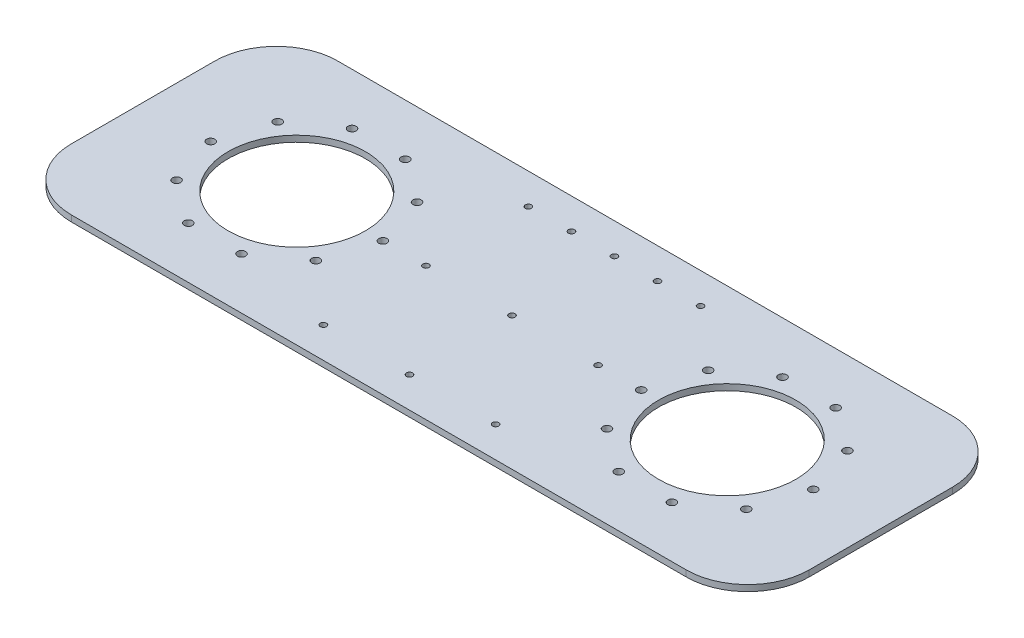
from build123d import *

# Parameters (mm, degrees)
SKETCH_1_R               = 33.5
EXTRUDE_1_DEPTH          = 3
CUT_EXTRUDE_1_REACH      = 193.4
SKETCH_3_R               = 2
PATTERN_CIRCULAR_1_COUNT = 10
MIRROR_1_COPY_1_REACH    = 193.4
MIRROR_1_COPY_1_SKETCH_R = 2
MIRROR_1_COPY_2_REACH    = 193.4
MIRROR_1_COPY_2_SKETCH_R = 2
MIRROR_1_COPY_3_REACH    = 193.4
MIRROR_1_COPY_3_SKETCH_R = 2
MIRROR_1_COPY_4_REACH    = 193.4
MIRROR_1_COPY_4_SKETCH_R = 2
MIRROR_1_COPY_5_REACH    = 193.4
MIRROR_1_COPY_5_SKETCH_R = 2
MIRROR_1_COPY_6_REACH    = 193.4
MIRROR_1_COPY_6_SKETCH_R = 2
MIRROR_1_COPY_7_REACH    = 193.4
MIRROR_1_COPY_7_SKETCH_R = 2
MIRROR_1_COPY_8_REACH    = 193.4
MIRROR_1_COPY_8_SKETCH_R = 2
MIRROR_1_COPY_9_REACH    = 193.4
MIRROR_1_COPY_9_SKETCH_R = 2
CUT_EXTRUDE_2_REACH      = 193.4
SKETCH_4_R               = 1.5
PATTERN_LINEAR_1_COUNT   = 5
PATTERN_LINEAR_1_PITCH   = 21
CUT_EXTRUDE_3_REACH      = 193.4
SKETCH_5_R               = 1.5
PATTERN_LINEAR_2_COUNT   = 2
PATTERN_LINEAR_2_PITCH   = 50


with BuildPart() as part:
    # 草圖1 → 填料-伸長1 (new body)
    with BuildSketch(Plane(origin=(0, 0, 0), x_dir=(1, 0, 0), z_dir=(0, 1, 0))):
        with BuildLine():
            Line((-150, 65), (150, 65))
            ThreePointArc((150, 65), (171.213203436, 56.213203436), (180, 35))
            Line((180, 35), (180, -35))
            ThreePointArc((180, -35), (171.213203436, -56.213203436), (150, -65))
            Line((150, -65), (-150, -65))
            ThreePointArc((-150, -65), (-171.213203436, -56.213203436), (-180, -35))
            Line((-180, -35), (-180, 35))
            ThreePointArc((-180, 35), (-171.213203436, 56.213203436), (-150, 65))
        make_face()
        with Locations(Location((105, 0, 0), (0, 0, 270))):
            Circle(SKETCH_1_R, mode=Mode.SUBTRACT)
        with Locations(Location((-105, 0, 0), (0, 0, 270))):
            Circle(SKETCH_1_R, mode=Mode.SUBTRACT)
    extrude(amount=EXTRUDE_1_DEPTH)

    # 草圖3 → 除料-伸長1 (cut, up to next)
    with BuildSketch(Plane(origin=(0, 3, 0), x_dir=(1, 0, 0), z_dir=(0, 1, 0)), mode=Mode.PRIVATE) as cut_extrude_1_sk1:
        with Locations(Location((-63, 0, 0), (0, 0, 270))):
            Circle(SKETCH_3_R)
    cut_extrude_1_tool1 = extrude(cut_extrude_1_sk1.sketch, amount=-CUT_EXTRUDE_1_REACH, mode=Mode.PRIVATE) & part.part
    cut_extrude_1 = cut_extrude_1_tool1.solids().sort_by_distance((-63, 3, 0))[0]
    add(cut_extrude_1, mode=Mode.SUBTRACT)

    # 環狀複製排列1: 除料-伸長1 ×10 about axis
    pattern_circular_1_axis = Axis((-105, 0, 0), (0, 1, 0))
    for i in range(1, PATTERN_CIRCULAR_1_COUNT):
        add(cut_extrude_1.rotate(pattern_circular_1_axis, i * 360 / PATTERN_CIRCULAR_1_COUNT), mode=Mode.SUBTRACT)

    # 鏡射1: 除料-伸長1 across plane
    add(cut_extrude_1.mirror(Plane(origin=(0, 0, 0), x_dir=(0, 0, 1), z_dir=(1, 0, 0))), mode=Mode.SUBTRACT)

    # 鏡射1 copy 1 sketch → 鏡射1 copy 1 (cut, up to next)
    with BuildSketch(Plane(origin=(20.053215591, 3, -61.717451491), x_dir=(-0.8090169943749475, 0, -0.5877852522924731), z_dir=(0, 1, 0)), mode=Mode.PRIVATE) as mirror_1_copy_1_sk1:
        with Locations((-63, 0)):
            Circle(MIRROR_1_COPY_1_SKETCH_R)
    mirror_1_copy_1_tool1 = extrude(mirror_1_copy_1_sk1.sketch, amount=-MIRROR_1_COPY_1_REACH, mode=Mode.PRIVATE) & part.part
    add(mirror_1_copy_1_tool1.solids().sort_by_distance((71.021286236, 3, -24.686980596))[0], mode=Mode.SUBTRACT)

    # 鏡射1 copy 2 sketch → 鏡射1 copy 2 (cut, up to next)
    with BuildSketch(Plane(origin=(72.553215591, 3, -99.860934211), x_dir=(-0.30901699437494745, 0, -0.9510565162951535), z_dir=(0, 1, 0)), mode=Mode.PRIVATE) as mirror_1_copy_2_sk1:
        with Locations((-63, 0)):
            Circle(MIRROR_1_COPY_2_SKETCH_R)
    mirror_1_copy_2_tool1 = extrude(mirror_1_copy_2_sk1.sketch, amount=-MIRROR_1_COPY_2_REACH, mode=Mode.PRIVATE) & part.part
    add(mirror_1_copy_2_tool1.solids().sort_by_distance((92.021286236, 3, -39.944373684))[0], mode=Mode.SUBTRACT)

    # 鏡射1 copy 3 sketch → 鏡射1 copy 3 (cut, up to next)
    with BuildSketch(Plane(origin=(137.446784409, 3, -99.860934211), x_dir=(0.30901699437494734, 0, -0.9510565162951536), z_dir=(0, 1, 0)), mode=Mode.PRIVATE) as mirror_1_copy_3_sk1:
        with Locations((-63, 0)):
            Circle(MIRROR_1_COPY_3_SKETCH_R)
    mirror_1_copy_3_tool1 = extrude(mirror_1_copy_3_sk1.sketch, amount=-MIRROR_1_COPY_3_REACH, mode=Mode.PRIVATE) & part.part
    add(mirror_1_copy_3_tool1.solids().sort_by_distance((117.978713764, 3, -39.944373684))[0], mode=Mode.SUBTRACT)

    # 鏡射1 copy 4 sketch → 鏡射1 copy 4 (cut, up to next)
    with BuildSketch(Plane(origin=(189.946784409, 3, -61.717451491), x_dir=(0.8090169943749473, 0, -0.5877852522924732), z_dir=(0, 1, 0)), mode=Mode.PRIVATE) as mirror_1_copy_4_sk1:
        with Locations((-63, 0)):
            Circle(MIRROR_1_COPY_4_SKETCH_R)
    mirror_1_copy_4_tool1 = extrude(mirror_1_copy_4_sk1.sketch, amount=-MIRROR_1_COPY_4_REACH, mode=Mode.PRIVATE) & part.part
    add(mirror_1_copy_4_tool1.solids().sort_by_distance((138.978713764, 3, -24.686980596))[0], mode=Mode.SUBTRACT)

    # 鏡射1 copy 5 sketch → 鏡射1 copy 5 (cut, up to next)
    with BuildSketch(Plane(origin=(210, 3, 0), x_dir=(1, 0, 0), z_dir=(0, 1, 0)), mode=Mode.PRIVATE) as mirror_1_copy_5_sk1:
        with Locations((-63, 0)):
            Circle(MIRROR_1_COPY_5_SKETCH_R)
    mirror_1_copy_5_tool1 = extrude(mirror_1_copy_5_sk1.sketch, amount=-MIRROR_1_COPY_5_REACH, mode=Mode.PRIVATE) & part.part
    add(mirror_1_copy_5_tool1.solids().sort_by_distance((147, 3, 0))[0], mode=Mode.SUBTRACT)

    # 鏡射1 copy 6 sketch → 鏡射1 copy 6 (cut, up to next)
    with BuildSketch(Plane(origin=(189.946784409, 3, 61.717451491), x_dir=(0.8090169943749476, 0, 0.587785252292473), z_dir=(0, 1, 0)), mode=Mode.PRIVATE) as mirror_1_copy_6_sk1:
        with Locations((-63, 0)):
            Circle(MIRROR_1_COPY_6_SKETCH_R)
    mirror_1_copy_6_tool1 = extrude(mirror_1_copy_6_sk1.sketch, amount=-MIRROR_1_COPY_6_REACH, mode=Mode.PRIVATE) & part.part
    add(mirror_1_copy_6_tool1.solids().sort_by_distance((138.978713764, 3, 24.686980596))[0], mode=Mode.SUBTRACT)

    # 鏡射1 copy 7 sketch → 鏡射1 copy 7 (cut, up to next)
    with BuildSketch(Plane(origin=(137.446784409, 3, 99.860934211), x_dir=(0.30901699437494756, 0, 0.9510565162951535), z_dir=(0, 1, 0)), mode=Mode.PRIVATE) as mirror_1_copy_7_sk1:
        with Locations((-63, 0)):
            Circle(MIRROR_1_COPY_7_SKETCH_R)
    mirror_1_copy_7_tool1 = extrude(mirror_1_copy_7_sk1.sketch, amount=-MIRROR_1_COPY_7_REACH, mode=Mode.PRIVATE) & part.part
    add(mirror_1_copy_7_tool1.solids().sort_by_distance((117.978713764, 3, 39.944373684))[0], mode=Mode.SUBTRACT)

    # 鏡射1 copy 8 sketch → 鏡射1 copy 8 (cut, up to next)
    with BuildSketch(Plane(origin=(72.553215591, 3, 99.860934211), x_dir=(-0.30901699437494723, 0, 0.9510565162951536), z_dir=(0, 1, 0)), mode=Mode.PRIVATE) as mirror_1_copy_8_sk1:
        with Locations((-63, 0)):
            Circle(MIRROR_1_COPY_8_SKETCH_R)
    mirror_1_copy_8_tool1 = extrude(mirror_1_copy_8_sk1.sketch, amount=-MIRROR_1_COPY_8_REACH, mode=Mode.PRIVATE) & part.part
    add(mirror_1_copy_8_tool1.solids().sort_by_distance((92.021286236, 3, 39.944373684))[0], mode=Mode.SUBTRACT)

    # 鏡射1 copy 9 sketch → 鏡射1 copy 9 (cut, up to next)
    with BuildSketch(Plane(origin=(20.053215591, 3, 61.717451491), x_dir=(-0.8090169943749473, 0, 0.5877852522924734), z_dir=(0, 1, 0)), mode=Mode.PRIVATE) as mirror_1_copy_9_sk1:
        with Locations((-63, 0)):
            Circle(MIRROR_1_COPY_9_SKETCH_R)
    mirror_1_copy_9_tool1 = extrude(mirror_1_copy_9_sk1.sketch, amount=-MIRROR_1_COPY_9_REACH, mode=Mode.PRIVATE) & part.part
    add(mirror_1_copy_9_tool1.solids().sort_by_distance((71.021286236, 3, 24.686980596))[0], mode=Mode.SUBTRACT)

    # 草圖4 → 除料-伸長2 (cut, up to next)
    with BuildSketch(Plane(origin=(0, 3, 0), x_dir=(1, 0, 0), z_dir=(0, 1, 0)), mode=Mode.PRIVATE) as cut_extrude_2_sk1:
        with Locations(Location((42, 50, 0), (0, 0, 270))):
            Circle(SKETCH_4_R)
    cut_extrude_2_tool1 = extrude(cut_extrude_2_sk1.sketch, amount=-CUT_EXTRUDE_2_REACH, mode=Mode.PRIVATE) & part.part
    cut_extrude_2 = cut_extrude_2_tool1.solids().sort_by_distance((42, 3, -50))[0]
    add(cut_extrude_2, mode=Mode.SUBTRACT)

    # 直線複製排列1: 除料-伸長2 ×5
    with Locations(*[(-i * PATTERN_LINEAR_1_PITCH, 0, 0) for i in range(1, PATTERN_LINEAR_1_COUNT)]):
        add(cut_extrude_2, mode=Mode.SUBTRACT)

    # 草圖5 → 除料-伸長3 (cut, up to next)
    with BuildSketch(Plane(origin=(0, 3, 0), x_dir=(1, 0, 0), z_dir=(0, 1, 0)), mode=Mode.PRIVATE) as cut_extrude_3_sk1:
        with Locations(Location((42, 0, 0), (0, 0, 270))):
            Circle(SKETCH_5_R)
    cut_extrude_3_tool1 = extrude(cut_extrude_3_sk1.sketch, amount=-CUT_EXTRUDE_3_REACH, mode=Mode.PRIVATE) & part.part
    # 草圖5 → 除料-伸長3 (cut, up to next)
    with BuildSketch(Plane(origin=(0, 3, 0), x_dir=(1, 0, 0), z_dir=(0, 1, 0)), mode=Mode.PRIVATE) as cut_extrude_3_sk2:
        with Locations(Location((0, 0, 0), (0, 0, 270))):
            Circle(SKETCH_5_R)
    cut_extrude_3_tool2 = extrude(cut_extrude_3_sk2.sketch, amount=-CUT_EXTRUDE_3_REACH, mode=Mode.PRIVATE) & part.part
    # 草圖5 → 除料-伸長3 (cut, up to next)
    with BuildSketch(Plane(origin=(0, 3, 0), x_dir=(1, 0, 0), z_dir=(0, 1, 0)), mode=Mode.PRIVATE) as cut_extrude_3_sk3:
        with Locations(Location((-42, 0, 0), (0, 0, 270))):
            Circle(SKETCH_5_R)
    cut_extrude_3_tool3 = extrude(cut_extrude_3_sk3.sketch, amount=-CUT_EXTRUDE_3_REACH, mode=Mode.PRIVATE) & part.part
    cut_extrude_3_1 = cut_extrude_3_tool1.solids().sort_by_distance((42, 3, 0))[0]
    add(cut_extrude_3_1, mode=Mode.SUBTRACT)
    cut_extrude_3_2 = cut_extrude_3_tool2.solids().sort_by_distance((0, 3, 0))[0]
    add(cut_extrude_3_2, mode=Mode.SUBTRACT)
    cut_extrude_3_3 = cut_extrude_3_tool3.solids().sort_by_distance((-42, 3, 0))[0]
    add(cut_extrude_3_3, mode=Mode.SUBTRACT)
    cut_extrude_3 = cut_extrude_3_1 + cut_extrude_3_2 + cut_extrude_3_3  # 除料-伸長3 as one shape, for the pattern or mirror that repeats it

    # 直線複製排列2: 除料-伸長3 ×2
    with Locations(*[(0, 0, i * PATTERN_LINEAR_2_PITCH) for i in range(1, PATTERN_LINEAR_2_COUNT)]):
        add(cut_extrude_3, mode=Mode.SUBTRACT)


solid = part.part
